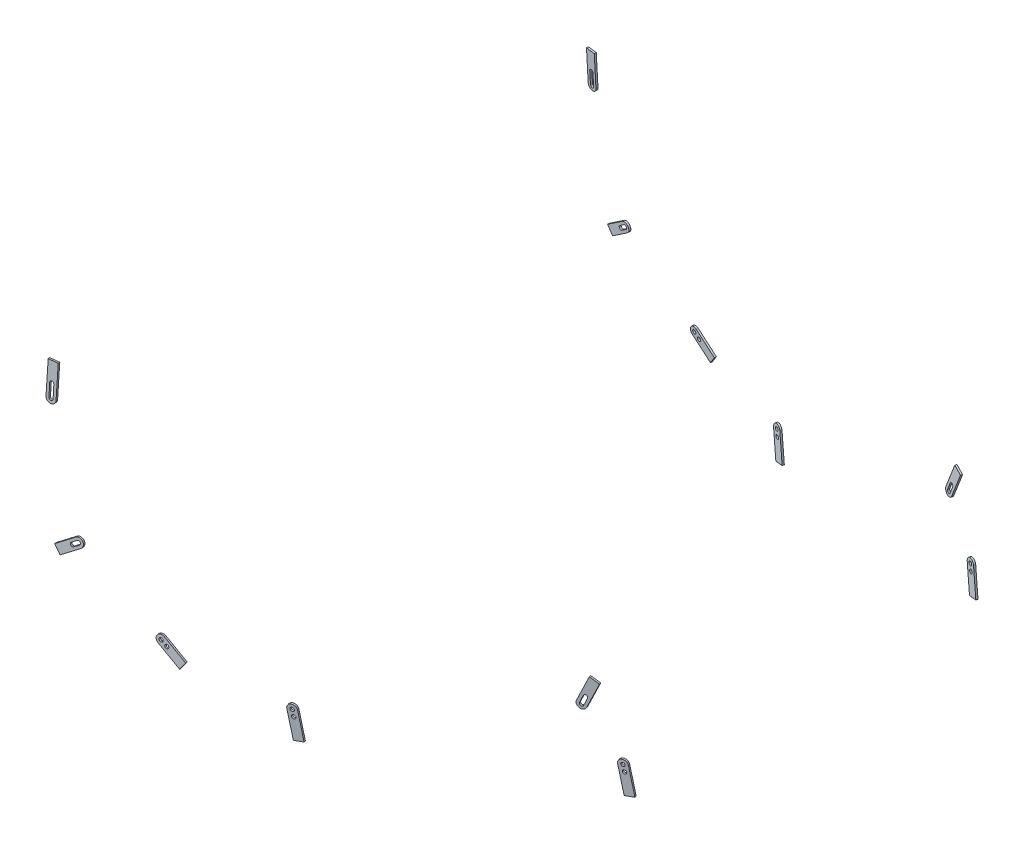
from build123d import *

# Parameters (mm, degrees)
BOSS_EXTRUDE4_DEPTH   = 2
BOSS_EXTRUDE4_2_DEPTH = 2
SKETCH2_R             = 2.05
BOSS_EXTRUDE4_3_DEPTH = 2
SKETCH5_R             = 2.05
BOSS_EXTRUDE5_DEPTH   = 2
BOSS_EXTRUDE5_2_DEPTH = 2
BOSS_EXTRUDE5_3_DEPTH = 2


with BuildPart() as part:
    # Sketch2 → Boss-Extrude4 (new body)
    with BuildSketch(Plane(origin=(41.651856591, 19.779294142, -326.440560119), x_dir=(-0.9919870120810848, 0.007641021627565833, -0.12610861449928398), z_dir=(0.12633989022649156, 0.05999525723813396, -0.9901710969557171))):
        with BuildLine():
            Line((-77.677639424, 167.093053138), (-71.77766818, 175.1671066))
            Line((-71.77766818, 175.1671066), (-91.962801835, 189.917034712))
            ThreePointArc((-91.962801835, 189.917034712), (-98.949814189, 188.829993603), (-97.86277308, 181.84298125))
            Line((-97.86277308, 181.84298125), (-77.677639424, 167.093053138))
        make_face()
        with BuildLine():
            Line((-93.703293353, 187.535188941), (-88.051455929, 183.405209069))
            ThreePointArc((-88.051455929, 183.405209069), (-87.605769074, 180.540534004), (-90.470444139, 180.09484715))
            Line((-90.470444139, 180.09484715), (-96.122281563, 184.224827021))
            ThreePointArc((-96.122281563, 184.224827021), (-96.567968417, 187.089502086), (-93.703293353, 187.535188941))
        make_face(mode=Mode.SUBTRACT)
    extrude(amount=BOSS_EXTRUDE4_DEPTH)


with BuildPart() as body_2:
    # Sketch2 → Boss-Extrude4 2 (new body)
    with BuildSketch(Plane(origin=(41.651856591, 19.779294142, -326.440560119), x_dir=(-0.9919870120810848, 0.007641021627565833, -0.12610861449928398), z_dir=(0.12633989022649156, 0.05999525723813396, -0.9901710969557171))):
        with BuildLine():
            Line((-56.387545648, 341.904250606), (-66.387545648, 341.826504105))
            Line((-66.387545648, 341.826504105), (-66.115432894, 306.826504105))
            ThreePointArc((-66.115432894, 306.826504105), (-61.076559643, 301.865377355), (-56.115432894, 306.904250606))
            Line((-56.115432894, 306.904250606), (-56.387545648, 341.904250606))
        make_face()
        with BuildLine():
            Line((-59.065432894, 320.865377355), (-59.065432894, 306.865377355))
            ThreePointArc((-59.065432894, 306.865377355), (-61.115432894, 304.815377355), (-63.165432894, 306.865377355))
            Line((-63.165432894, 306.865377355), (-63.165432894, 320.865377355))
            ThreePointArc((-63.165432894, 320.865377355), (-61.115432894, 322.915377355), (-59.065432894, 320.865377355))
        make_face(mode=Mode.SUBTRACT)
    extrude(amount=BOSS_EXTRUDE4_2_DEPTH)


with BuildPart() as body_3:
    # Sketch2 → Boss-Extrude4 3 (new body)
    with BuildSketch(Plane(origin=(41.651856591, 19.779294142, -326.440560119), x_dir=(-0.9919870120810848, 0.007641021627565833, -0.12610861449928398), z_dir=(0.12633989022649156, 0.05999525723813396, -0.9901710969557171))):
        with BuildLine():
            Line((-205.318476509, 120.355341308), (-199.65483142, 112.113792648))
            Line((-199.65483142, 112.113792648), (-177.40265004, 127.40563439))
            ThreePointArc((-177.40265004, 127.40563439), (-176.113698255, 134.358231264), (-183.06629513, 135.647183049))
            Line((-183.06629513, 135.647183049), (-205.318476509, 120.355341308))
        make_face()
        with Locations(Location((-186.003556646, 127.561857157, 0), (0, 0, 179.56140738))):
            Circle(SKETCH2_R, mode=Mode.SUBTRACT)
        with Locations(Location((-180.234472585, 131.526408719, 0), (0, 0, 179.56140738))):
            Circle(SKETCH2_R, mode=Mode.SUBTRACT)
    extrude(amount=BOSS_EXTRUDE4_3_DEPTH)


with BuildPart() as body_4:
    # Sketch5 → Boss-Extrude5 (new body)
    with BuildSketch(Plane(origin=(88.750320765, -11.890035679, -330.939281141), x_dir=(0.9659125579482118, 0.00929467103739858, 0.2587016418352406), z_dir=(-0.25886855814861437, 0.03468107344217029, 0.9652897454893823))):
        with BuildLine():
            Line((571.229456002, 161.440225718), (561.373301075, 159.750193156))
            Line((561.373301075, 159.750193156), (556.303203387, 189.318657936))
            ThreePointArc((556.303203387, 189.318657936), (560.386264569, 195.09175168), (566.159358314, 191.008690498))
            Line((566.159358314, 191.008690498), (571.229456002, 161.440225718))
        make_face()
        with Locations(Location((561.23128085, 190.163674217, 0), (0, 0, 359.46712634))):
            Circle(SKETCH5_R, mode=Mode.SUBTRACT)
        with Locations(Location((562.414303644, 183.264365768, 0), (0, 0, 359.46712634))):
            Circle(SKETCH5_R, mode=Mode.SUBTRACT)
    extrude(amount=-BOSS_EXTRUDE5_DEPTH)


with BuildPart() as body_5:
    # Sketch5 → Boss-Extrude5 2 (new body)
    with BuildSketch(Plane(origin=(88.750320765, -11.890035679, -330.939281141), x_dir=(0.9659125579482118, 0.00929467103739858, 0.2587016418352406), z_dir=(-0.25886855814861437, 0.03468107344217029, 0.9652897454893823))):
        with BuildLine():
            Line((269.121028557, 109.637764859), (259.264873631, 107.947732296))
            Line((259.264873631, 107.947732296), (254.194775943, 137.516197076))
            ThreePointArc((254.194775943, 137.516197076), (258.277837125, 143.289290821), (264.05093087, 139.206229639))
            Line((264.05093087, 139.206229639), (269.121028557, 109.637764859))
        make_face()
        with Locations(Location((259.122853406, 138.361213357, 0), (0, 0, 359.46712634))):
            Circle(SKETCH5_R, mode=Mode.SUBTRACT)
        with Locations(Location((260.281862551, 131.457830288, 0), (0, 0, 359.46712634))):
            Circle(SKETCH5_R, mode=Mode.SUBTRACT)
    extrude(amount=-BOSS_EXTRUDE5_2_DEPTH)


with BuildPart() as body_6:
    # Sketch5 → Boss-Extrude5 3 (new body)
    with BuildSketch(Plane(origin=(88.750320765, -11.890035679, -330.939281141), x_dir=(0.9659125579482118, 0.00929467103739858, 0.2587016418352406), z_dir=(-0.25886855814861437, 0.03468107344217029, 0.9652897454893823))):
        with BuildLine():
            Line((541.960826136, 262.212280243), (532.866749685, 266.371339453))
            Line((532.866749685, 266.371339453), (520.389572054, 239.089110102))
            ThreePointArc((520.389572054, 239.089110102), (522.857080674, 232.462542272), (529.483648504, 234.930050892))
            Line((529.483648504, 234.930050892), (541.960826136, 262.212280243))
        make_face()
        with BuildLine():
            Line((523.072324607, 237.862187635), (526.815477896, 246.046856441))
            ThreePointArc((526.815477896, 246.046856441), (529.532370707, 247.058534975), (530.544049241, 244.341642164))
            Line((530.544049241, 244.341642164), (526.800895952, 236.156973359))
            ThreePointArc((526.800895952, 236.156973359), (524.084003141, 235.145294825), (523.072324607, 237.862187635))
        make_face(mode=Mode.SUBTRACT)
    extrude(amount=-BOSS_EXTRUDE5_3_DEPTH)


with BuildPart() as body_7:
    # Mirror3: mirrored copy
    add(body_6.part.mirror(Plane.XY))


with BuildPart() as body_8:
    # Mirror3 2: mirrored copy
    add(body_4.part.mirror(Plane.XY))


with BuildPart() as body_9:
    # Mirror3 3: mirrored copy
    add(body_5.part.mirror(Plane.XY))


with BuildPart() as body_10:
    # Mirror3 4: mirrored copy
    add(body_3.part.mirror(Plane.XY))


with BuildPart() as body_11:
    # Mirror3 5: mirrored copy
    add(part.part.mirror(Plane.XY))


with BuildPart() as body_12:
    # Mirror3 6: mirrored copy
    add(body_2.part.mirror(Plane.XY))


solid = Compound([part.part, body_2.part, body_3.part, body_4.part, body_5.part, body_6.part, body_7.part, body_8.part, body_9.part, body_10.part, body_11.part, body_12.part])
